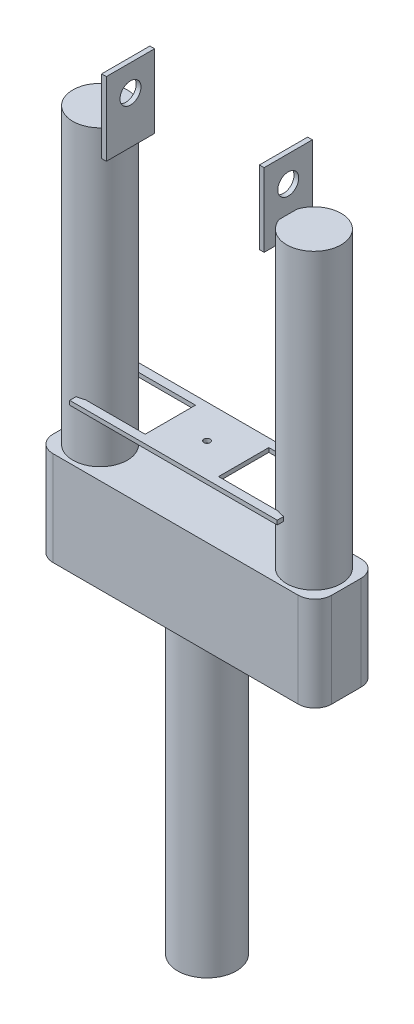
from build123d import *

# Parameters (mm, degrees)
SKETCH1_R               = 14
BOSS_EXTRUDE1_DEPTH     = 140
SKETCH2_W               = 133
SKETCH2_H               = 30
BOSS_EXTRUDE2_DEPTH     = 45
SKETCH3_R               = 13
BOSS_EXTRUDE3_DEPTH     = 140
FILLET1_R               = 8
BOSS_EXTRUDE4_START     = -10
SKETCH5_W               = 2.25
SKETCH5_H               = 23
BOSS_EXTRUDE4_DEPTH     = 35
CUT_EXTRUDE1_DEPTH      = 366.14928454
CUT_EXTRUDE1_DEPTH_BACK = 366.14928454
SKETCH6_R               = 5
BOSS_EXTRUDE5_START     = -140
BOSS_EXTRUDE5_DEPTH     = 2
CUT_EXTRUDE2_REACH      = 224.761
SKETCH9_R               = 1.5
SKETCH10_R              = 11
CUT_EXTRUDE3_DEPTH      = 100


with BuildPart() as part:
    # Sketch1 → Boss-Extrude1 (new body)
    with BuildSketch(Plane(origin=(0, 0, 0), x_dir=(1, 0, 0), z_dir=(0, 1, 0))):
        with Locations(Location((0, 0, 0), (0, 0, 270))):
            Circle(SKETCH1_R)
    extrude(amount=BOSS_EXTRUDE1_DEPTH)

    # Sketch2 → Boss-Extrude2 (add)
    with BuildSketch(Plane(origin=(0, 140, 0), x_dir=(1, 0, 0), z_dir=(0, 1, 0))):
        Rectangle(SKETCH2_W, SKETCH2_H)
    extrude(amount=BOSS_EXTRUDE2_DEPTH)

    # Sketch3 → Boss-Extrude3 (add)
    with BuildSketch(Plane(origin=(0, 185, 0), x_dir=(1, 0, 0), z_dir=(0, 1, 0))):
        with Locations(Location((-51, 0, 0), (0, 0, 270))):
            Circle(SKETCH3_R)
        with Locations(Location((51, 0, 0), (0, 0, 270))):
            Circle(SKETCH3_R)
    extrude(amount=BOSS_EXTRUDE3_DEPTH)

    # Fillet1
    fillet1_edges = [part.edges().sort_by_distance(p)[0] for p in [
        (-66.5, 162.5, 15),
        (66.5, 162.5, 15),
        (66.5, 162.5, -15),
        (-66.5, 162.5, -15),
    ]]
    fillet(fillet1_edges, radius=FILLET1_R)

    # Sketch5 → Boss-Extrude4 (add)
    with BuildSketch(Plane(origin=(0, 325, 0), x_dir=(1, 0, 0), z_dir=(0, 1, 0)).offset(BOSS_EXTRUDE4_START)):
        with Locations((-37.625, 0)):
            Rectangle(SKETCH5_W, SKETCH5_H)
        with Locations((37.625, 0)):
            Rectangle(SKETCH5_W, SKETCH5_H)
    extrude(amount=BOSS_EXTRUDE4_DEPTH)

    # Sketch6 → Cut-Extrude1 (cut, two sides: drawn at the far end of the back side and taken through both)
    with BuildSketch(Plane(origin=(-36.5, 0, 0), x_dir=(0, 0, -1), z_dir=(1, 0, 0)).offset(-CUT_EXTRUDE1_DEPTH_BACK)):
        with Locations((0, 337.5)):
            Circle(SKETCH6_R)
    extrude(amount=CUT_EXTRUDE1_DEPTH + CUT_EXTRUDE1_DEPTH_BACK, mode=Mode.SUBTRACT)

    # Sketch8 → Boss-Extrude5 (add)
    with BuildSketch(Plane(origin=(0, 350, 0), x_dir=(1, 0, 0), z_dir=(0, 1, 0)).offset(BOSS_EXTRUDE5_START)):
        Polygon((17.5, 16), (-17.5, 16), (-49.5, 16), (-49.5, 12), (-17.5, 12), (-17.5, -12), (-49.5, -12), (-49.5, -16), (-17.5, -16), (17.5, -16), (49.5, -16), (49.5, -12), (17.5, -12), (17.5, 12), (49.5, 12), (49.5, 16), align=None)
    extrude(amount=BOSS_EXTRUDE5_DEPTH)

    # Sketch9 → Cut-Extrude2 (cut, up to next)
    with BuildSketch(Plane(origin=(0, 212, 0), x_dir=(1, 0, 0), z_dir=(0, 1, 0)), mode=Mode.PRIVATE) as cut_extrude2_sk1:
        with Locations(Location((0, 0, 0), (0, 0, 270))):
            Circle(SKETCH9_R)
    cut_extrude2_tool1 = extrude(cut_extrude2_sk1.sketch, amount=-CUT_EXTRUDE2_REACH, mode=Mode.PRIVATE) & part.part
    add(cut_extrude2_tool1.solids().sort_by_distance((0, 212, 0))[0], mode=Mode.SUBTRACT)

    # Sketch10 → Cut-Extrude3 (cut)
    with BuildSketch(Plane.XZ):
        with Locations(Location((0, 0, 0), (0, 0, 270))):
            Circle(SKETCH10_R)
    extrude(amount=-CUT_EXTRUDE3_DEPTH, mode=Mode.SUBTRACT)


solid = part.part
